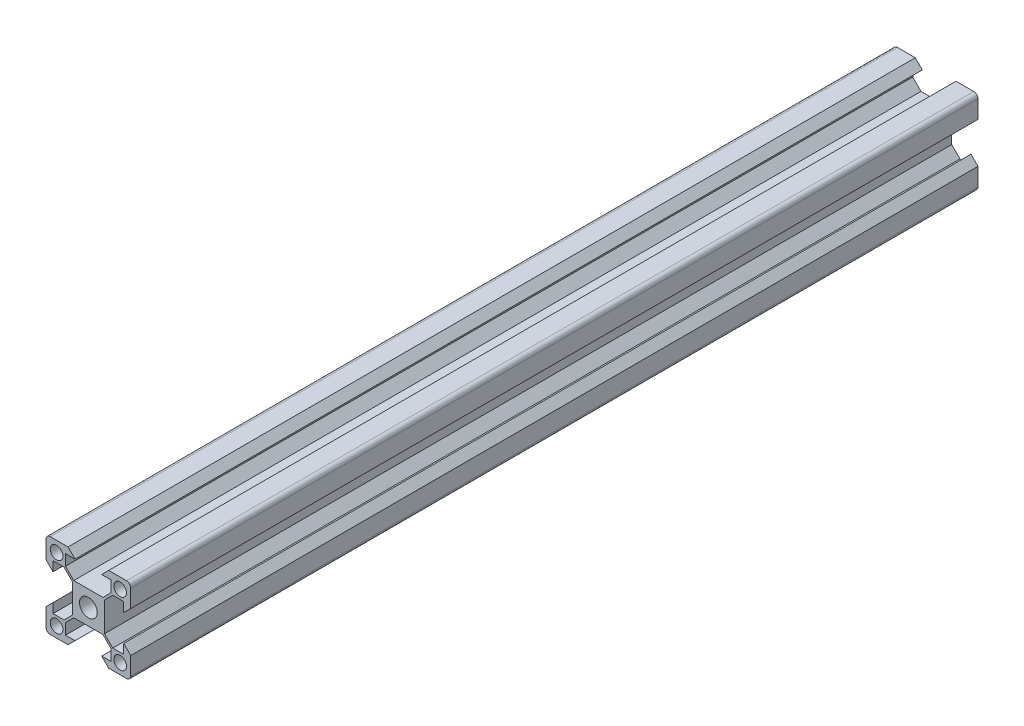
from build123d import *

# Parameters (mm, degrees)
SKETCH_1_R      = 1.5
SKETCH_1_R_2    = 2.1
EXTRUDE_1_DEPTH = 100
FILLET_1_R      = 1


with BuildPart() as part:
    # 草图1 → 凸台-拉伸1 (new, symmetric)
    with BuildSketch(Plane.XY):
        Polygon((-10, 10), (-10, 4.8), (-8.34, 3.14), (-8.34, 5.4), (-5.753553391, 5.4), (-3.8, 3.446446609), (-3.8, -3.446446609), (-5.753553391, -5.4), (-8.34, -5.4), (-8.34, -3.14), (-10, -4.8), (-10, -10), (-4.8, -10), (-3.14, -8.34), (-5.4, -8.34), (-5.4, -5.753553391), (-3.446446609, -3.8), (3.446446609, -3.8), (5.4, -5.753553391), (5.4, -8.34), (3.14, -8.34), (4.8, -10), (10, -10), (10, -4.8), (8.34, -3.14), (8.34, -5.4), (5.753553391, -5.4), (3.8, -3.446446609), (3.8, 3.446446609), (5.753553391, 5.4), (8.34, 5.4), (8.34, 3.14), (10, 4.8), (10, 10), (4.8, 10), (3.14, 8.34), (5.4, 8.34), (5.4, 5.753553391), (3.446446609, 3.8), (-3.446446609, 3.8), (-5.4, 5.753553391), (-5.4, 8.34), (-3.14, 8.34), (-4.8, 10), align=None)
        with Locations((-7.5, 7.5)):
            Circle(SKETCH_1_R, mode=Mode.SUBTRACT)
        Circle(SKETCH_1_R_2, mode=Mode.SUBTRACT)
        with Locations(Location((-7.5, -7.5, 0), (0, 0, 180))):
            Circle(SKETCH_1_R, mode=Mode.SUBTRACT)
        with Locations((7.5, -7.5)):
            Circle(SKETCH_1_R, mode=Mode.SUBTRACT)
        with Locations(Location((7.5, 7.5, 0), (0, 0, 180))):
            Circle(SKETCH_1_R, mode=Mode.SUBTRACT)
    extrude(amount=EXTRUDE_1_DEPTH, both=True)

    # 圆角1
    fillet_1_edges = [part.edges().sort_by_distance(p)[0] for p in [
        (10, 10, 0),
        (10, -10, 0),
        (-10, -10, 0),
        (-10, 10, 0),
    ]]
    fillet(fillet_1_edges, radius=FILLET_1_R)


solid = part.part
